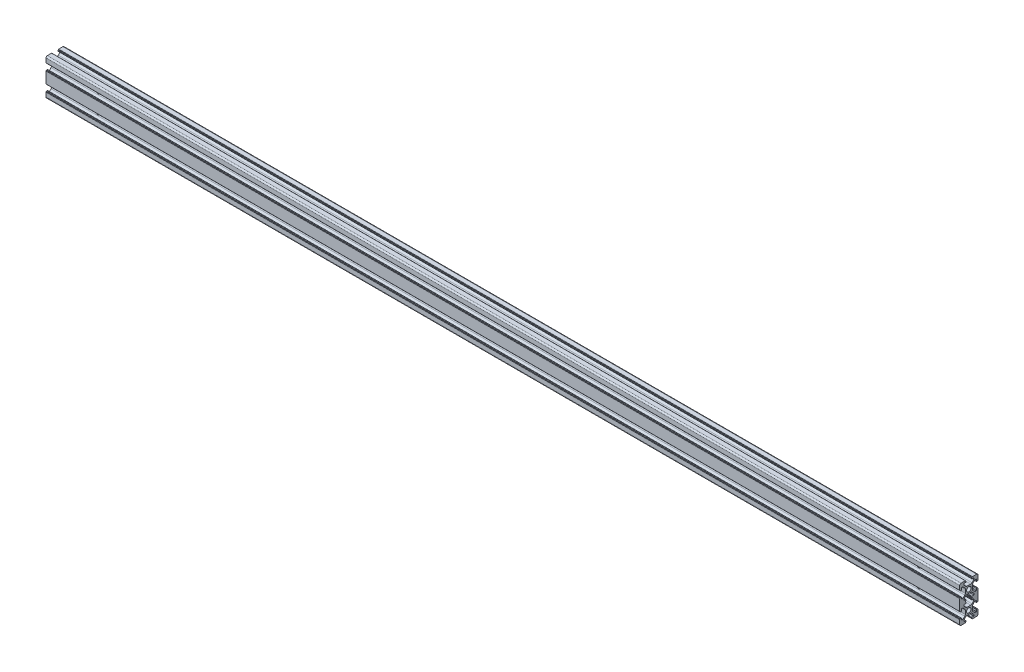
from build123d import *

# Parameters (mm, degrees)
SKETCH11_R                        = 2.500261559
F_2020_V_SLOT_2040_V_SLOT_1_DEPTH = 1000
M5_CLEARANCE_HOLE1_D              = 5.8


with BuildPart() as part:
    # Sketch11 → 2020 v-slot 2040 - V-SLOT(1) (new body)
    with BuildSketch(Plane(origin=(-500, 0, 0), x_dir=(0, 0, 1), z_dir=(1, 0, 0))):
        with BuildLine():
            Line((9.7, 6.4), (9.5, 6.4))
            Line((9.5, 6.4), (9.5, 6.6))
            ThreePointArc((9.5, 6.6), (9.412132034, 6.812132034), (9.2, 6.9))
            Line((9.2, 6.9), (8.5, 6.9))
            ThreePointArc((8.5, 6.9), (8.287867966, 6.812132034), (8.2, 6.6))
            Line((8.2, 6.6), (8.2, 4.8))
            ThreePointArc((8.2, 4.8), (8.112132034, 4.587867966), (7.9, 4.5))
            Line((7.9, 4.5), (6.68492424, 4.5))
            ThreePointArc((6.68492424, 4.5), (6.570119211, 4.52283614), (6.472792206, 4.587867966))
            Line((6.472792206, 4.587867966), (4.485786438, 6.574873734))
            ThreePointArc((4.485786438, 6.574873734), (4.052240935, 7.223720432), (3.9, 7.989087297))
            Line((3.9, 7.989087297), (3.9, 12.010912703))
            ThreePointArc((3.9, 12.010912703), (4.052240935, 12.776279568), (4.485786438, 13.425126266))
            Line((4.485786438, 13.425126266), (6.472792206, 15.412132034))
            ThreePointArc((6.472792206, 15.412132034), (6.570119211, 15.47716386), (6.68492424, 15.5))
            Line((6.68492424, 15.5), (7.9, 15.5))
            ThreePointArc((7.9, 15.5), (8.112132034, 15.412132034), (8.2, 15.2))
            Line((8.2, 15.2), (8.2, 13.4))
            ThreePointArc((8.2, 13.4), (8.287867966, 13.187867966), (8.5, 13.1))
            Line((8.5, 13.1), (9.2, 13.1))
            ThreePointArc((9.2, 13.1), (9.412132034, 13.187867966), (9.5, 13.4))
            Line((9.5, 13.4), (9.5, 13.6))
            Line((9.5, 13.6), (9.7, 13.6))
            ThreePointArc((9.7, 13.6), (9.912132034, 13.687867966), (10, 13.9))
            Line((10, 13.9), (10, 18.5))
            ThreePointArc((10, 18.5), (9.560660172, 19.560660172), (8.5, 20))
            Line((8.5, 20), (3.9, 20))
            ThreePointArc((3.9, 20), (3.687867966, 19.912132034), (3.6, 19.7))
            Line((3.6, 19.7), (3.6, 19.5))
            Line((3.6, 19.5), (3.4, 19.5))
            ThreePointArc((3.4, 19.5), (3.187867966, 19.412132034), (3.1, 19.2))
            Line((3.1, 19.2), (3.1, 18.5))
            ThreePointArc((3.1, 18.5), (3.187867966, 18.287867966), (3.4, 18.2))
            Line((3.4, 18.2), (5.2, 18.2))
            ThreePointArc((5.2, 18.2), (5.412132034, 18.112132034), (5.5, 17.9))
            Line((5.5, 17.9), (5.5, 16.68492424))
            ThreePointArc((5.5, 16.68492424), (5.47716386, 16.570119211), (5.412132034, 16.472792206))
            Line((5.412132034, 16.472792206), (3.425126266, 14.485786438))
            ThreePointArc((3.425126266, 14.485786438), (2.776279568, 14.052240935), (2.010912703, 13.9))
            Line((2.010912703, 13.9), (-2.010912703, 13.9))
            ThreePointArc((-2.010912703, 13.9), (-2.776279568, 14.052240935), (-3.425126266, 14.485786438))
            Line((-3.425126266, 14.485786438), (-5.412132034, 16.472792206))
            ThreePointArc((-5.412132034, 16.472792206), (-5.47716386, 16.570119211), (-5.5, 16.68492424))
            Line((-5.5, 16.68492424), (-5.5, 17.9))
            ThreePointArc((-5.5, 17.9), (-5.412132034, 18.112132034), (-5.2, 18.2))
            Line((-5.2, 18.2), (-3.4, 18.2))
            ThreePointArc((-3.4, 18.2), (-3.187867966, 18.287867966), (-3.1, 18.5))
            Line((-3.1, 18.5), (-3.1, 19.2))
            ThreePointArc((-3.1, 19.2), (-3.187867966, 19.412132034), (-3.4, 19.5))
            Line((-3.4, 19.5), (-3.6, 19.5))
            Line((-3.6, 19.5), (-3.6, 19.7))
            ThreePointArc((-3.6, 19.7), (-3.687867966, 19.912132034), (-3.9, 20))
            Line((-3.9, 20), (-8.5, 20))
            ThreePointArc((-8.5, 20), (-9.560660172, 19.560660172), (-10, 18.5))
            Line((-10, 18.5), (-10, 13.9))
            ThreePointArc((-10, 13.9), (-9.912132034, 13.687867966), (-9.7, 13.6))
            Line((-9.7, 13.6), (-9.5, 13.6))
            Line((-9.5, 13.6), (-9.5, 13.4))
            ThreePointArc((-9.5, 13.4), (-9.412132034, 13.187867966), (-9.2, 13.1))
            Line((-9.2, 13.1), (-8.5, 13.1))
            ThreePointArc((-8.5, 13.1), (-8.287867966, 13.187867966), (-8.2, 13.4))
            Line((-8.2, 13.4), (-8.2, 15.2))
            ThreePointArc((-8.2, 15.2), (-8.112132034, 15.412132034), (-7.9, 15.5))
            Line((-7.9, 15.5), (-6.68492424, 15.5))
            ThreePointArc((-6.68492424, 15.5), (-6.570119211, 15.47716386), (-6.472792206, 15.412132034))
            Line((-6.472792206, 15.412132034), (-4.485786438, 13.425126266))
            ThreePointArc((-4.485786438, 13.425126266), (-4.052240935, 12.776279568), (-3.9, 12.010912703))
            Line((-3.9, 12.010912703), (-3.9, 7.989087297))
            ThreePointArc((-3.9, 7.989087297), (-4.052240935, 7.223720432), (-4.485786438, 6.574873734))
            Line((-4.485786438, 6.574873734), (-6.472792206, 4.587867966))
            ThreePointArc((-6.472792206, 4.587867966), (-6.570119211, 4.52283614), (-6.68492424, 4.5))
            Line((-6.68492424, 4.5), (-7.9, 4.5))
            ThreePointArc((-7.9, 4.5), (-8.112132034, 4.587867966), (-8.2, 4.8))
            Line((-8.2, 4.8), (-8.2, 6.6))
            ThreePointArc((-8.2, 6.6), (-8.287867966, 6.812132034), (-8.5, 6.9))
            Line((-8.5, 6.9), (-9.2, 6.9))
            ThreePointArc((-9.2, 6.9), (-9.412132034, 6.812132034), (-9.5, 6.6))
            Line((-9.5, 6.6), (-9.5, 6.4))
            Line((-9.5, 6.4), (-9.7, 6.4))
            ThreePointArc((-9.7, 6.4), (-9.912132034, 6.312132034), (-10, 6.1))
            Line((-10, 6.1), (-10, 1.5))
            Line((-10, 1.5), (-10, -1.5))
            Line((-10, -1.5), (-10, -6.1))
            ThreePointArc((-10, -6.1), (-9.912132034, -6.312132034), (-9.7, -6.4))
            Line((-9.7, -6.4), (-9.5, -6.4))
            Line((-9.5, -6.4), (-9.5, -6.6))
            ThreePointArc((-9.5, -6.6), (-9.412132034, -6.812132034), (-9.2, -6.9))
            Line((-9.2, -6.9), (-8.5, -6.9))
            ThreePointArc((-8.5, -6.9), (-8.287867966, -6.812132034), (-8.2, -6.6))
            Line((-8.2, -6.6), (-8.2, -4.8))
            ThreePointArc((-8.2, -4.8), (-8.112132034, -4.587867966), (-7.9, -4.5))
            Line((-7.9, -4.5), (-6.68492424, -4.5))
            ThreePointArc((-6.68492424, -4.5), (-6.570119211, -4.52283614), (-6.472792206, -4.587867966))
            Line((-6.472792206, -4.587867966), (-4.485786438, -6.574873734))
            ThreePointArc((-4.485786438, -6.574873734), (-4.052240935, -7.223720432), (-3.9, -7.989087297))
            Line((-3.9, -7.989087297), (-3.9, -12.010912703))
            ThreePointArc((-3.9, -12.010912703), (-4.052240935, -12.776279568), (-4.485786438, -13.425126266))
            Line((-4.485786438, -13.425126266), (-6.472792206, -15.412132034))
            ThreePointArc((-6.472792206, -15.412132034), (-6.570119211, -15.47716386), (-6.68492424, -15.5))
            Line((-6.68492424, -15.5), (-7.9, -15.5))
            ThreePointArc((-7.9, -15.5), (-8.112132034, -15.412132034), (-8.2, -15.2))
            Line((-8.2, -15.2), (-8.2, -13.4))
            ThreePointArc((-8.2, -13.4), (-8.287867966, -13.187867966), (-8.5, -13.1))
            Line((-8.5, -13.1), (-9.2, -13.1))
            ThreePointArc((-9.2, -13.1), (-9.412132034, -13.187867966), (-9.5, -13.4))
            Line((-9.5, -13.4), (-9.5, -13.6))
            Line((-9.5, -13.6), (-9.7, -13.6))
            ThreePointArc((-9.7, -13.6), (-9.912132034, -13.687867966), (-10, -13.9))
            Line((-10, -13.9), (-10, -18.5))
            ThreePointArc((-10, -18.5), (-9.560660172, -19.560660172), (-8.5, -20))
            Line((-8.5, -20), (-3.9, -20))
            ThreePointArc((-3.9, -20), (-3.687867966, -19.912132034), (-3.6, -19.7))
            Line((-3.6, -19.7), (-3.6, -19.5))
            Line((-3.6, -19.5), (-3.4, -19.5))
            ThreePointArc((-3.4, -19.5), (-3.187867966, -19.412132034), (-3.1, -19.2))
            Line((-3.1, -19.2), (-3.1, -18.5))
            ThreePointArc((-3.1, -18.5), (-3.187867966, -18.287867966), (-3.4, -18.2))
            Line((-3.4, -18.2), (-5.2, -18.2))
            ThreePointArc((-5.2, -18.2), (-5.412132034, -18.112132034), (-5.5, -17.9))
            Line((-5.5, -17.9), (-5.5, -16.68492424))
            ThreePointArc((-5.5, -16.68492424), (-5.47716386, -16.570119211), (-5.412132034, -16.472792206))
            Line((-5.412132034, -16.472792206), (-3.425126266, -14.485786438))
            ThreePointArc((-3.425126266, -14.485786438), (-2.776279568, -14.052240935), (-2.010912703, -13.9))
            Line((-2.010912703, -13.9), (2.010912703, -13.9))
            ThreePointArc((2.010912703, -13.9), (2.776279568, -14.052240935), (3.425126266, -14.485786438))
            Line((3.425126266, -14.485786438), (5.412132034, -16.472792206))
            ThreePointArc((5.412132034, -16.472792206), (5.47716386, -16.570119211), (5.5, -16.68492424))
            Line((5.5, -16.68492424), (5.5, -17.9))
            ThreePointArc((5.5, -17.9), (5.412132034, -18.112132034), (5.2, -18.2))
            Line((5.2, -18.2), (3.4, -18.2))
            ThreePointArc((3.4, -18.2), (3.187867966, -18.287867966), (3.1, -18.5))
            Line((3.1, -18.5), (3.1, -19.2))
            ThreePointArc((3.1, -19.2), (3.187867966, -19.412132034), (3.4, -19.5))
            Line((3.4, -19.5), (3.6, -19.5))
            Line((3.6, -19.5), (3.6, -19.7))
            ThreePointArc((3.6, -19.7), (3.687867966, -19.912132034), (3.9, -20))
            Line((3.9, -20), (8.5, -20))
            ThreePointArc((8.5, -20), (9.560660172, -19.560660172), (10, -18.5))
            Line((10, -18.5), (10, -13.9))
            ThreePointArc((10, -13.9), (9.912132034, -13.687867966), (9.7, -13.6))
            Line((9.7, -13.6), (9.5, -13.6))
            Line((9.5, -13.6), (9.5, -13.4))
            ThreePointArc((9.5, -13.4), (9.412132034, -13.187867966), (9.2, -13.1))
            Line((9.2, -13.1), (8.5, -13.1))
            ThreePointArc((8.5, -13.1), (8.287867966, -13.187867966), (8.2, -13.4))
            Line((8.2, -13.4), (8.2, -15.2))
            ThreePointArc((8.2, -15.2), (8.112132034, -15.412132034), (7.9, -15.5))
            Line((7.9, -15.5), (6.68492424, -15.5))
            ThreePointArc((6.68492424, -15.5), (6.570119211, -15.47716386), (6.472792206, -15.412132034))
            Line((6.472792206, -15.412132034), (4.485786438, -13.425126266))
            ThreePointArc((4.485786438, -13.425126266), (4.052240935, -12.776279568), (3.9, -12.010912703))
            Line((3.9, -12.010912703), (3.9, -7.989087297))
            ThreePointArc((3.9, -7.989087297), (4.052240935, -7.223720432), (4.485786438, -6.574873734))
            Line((4.485786438, -6.574873734), (6.472792206, -4.587867966))
            ThreePointArc((6.472792206, -4.587867966), (6.570119211, -4.52283614), (6.68492424, -4.5))
            Line((6.68492424, -4.5), (7.9, -4.5))
            ThreePointArc((7.9, -4.5), (8.112132034, -4.587867966), (8.2, -4.8))
            Line((8.2, -4.8), (8.2, -6.6))
            ThreePointArc((8.2, -6.6), (8.287867966, -6.812132034), (8.5, -6.9))
            Line((8.5, -6.9), (9.2, -6.9))
            ThreePointArc((9.2, -6.9), (9.412132034, -6.812132034), (9.5, -6.6))
            Line((9.5, -6.6), (9.5, -6.4))
            Line((9.5, -6.4), (9.7, -6.4))
            ThreePointArc((9.7, -6.4), (9.912132034, -6.312132034), (10, -6.1))
            Line((10, -6.1), (10, -1.5))
            Line((10, -1.5), (10, 1.5))
            Line((10, 1.5), (10, 6.1))
            ThreePointArc((10, 6.1), (9.912132034, 6.312132034), (9.7, 6.4))
        make_face()
        with Locations((0.000261521, 10.000437397)):
            Circle(SKETCH11_R, mode=Mode.SUBTRACT)
        with Locations((0.000261521, -10.000437397)):
            Circle(SKETCH11_R, mode=Mode.SUBTRACT)
        with BuildLine():
            Line((-3.1, 0.8), (-3.1, 1.5))
            ThreePointArc((-3.1, 1.5), (-3.187867966, 1.712132034), (-3.4, 1.8))
            Line((-3.4, 1.8), (-5.2, 1.8))
            ThreePointArc((-5.2, 1.8), (-5.412132034, 1.887867966), (-5.5, 2.1))
            Line((-5.5, 2.1), (-5.5, 3.31507576))
            ThreePointArc((-5.5, 3.31507576), (-5.47716386, 3.429880789), (-5.412132034, 3.527207794))
            Line((-5.412132034, 3.527207794), (-3.425126266, 5.514213562))
            ThreePointArc((-3.425126266, 5.514213562), (-2.776279568, 5.947759065), (-2.010912703, 6.1))
            Line((-2.010912703, 6.1), (2.010912703, 6.1))
            ThreePointArc((2.010912703, 6.1), (2.776279568, 5.947759065), (3.425126266, 5.514213562))
            Line((3.425126266, 5.514213562), (5.412132034, 3.527207794))
            ThreePointArc((5.412132034, 3.527207794), (5.47716386, 3.429880789), (5.5, 3.31507576))
            Line((5.5, 3.31507576), (5.5, 2.1))
            ThreePointArc((5.5, 2.1), (5.412132034, 1.887867966), (5.2, 1.8))
            Line((5.2, 1.8), (3.4, 1.8))
            ThreePointArc((3.4, 1.8), (3.187867966, 1.712132034), (3.1, 1.5))
            Line((3.1, 1.5), (3.1, 0.8))
            ThreePointArc((3.1, 0.8), (3.187867966, 0.587867966), (3.4, 0.5))
            ThreePointArc((3.4, 0.5), (3.541421356, 0.441421356), (3.6, 0.3))
            ThreePointArc((3.6, 0.3), (3.687867966, 0.087867966), (3.9, 0))
            ThreePointArc((3.9, 0), (3.687867966, -0.087867966), (3.6, -0.3))
            ThreePointArc((3.6, -0.3), (3.541421356, -0.441421356), (3.4, -0.5))
            ThreePointArc((3.4, -0.5), (3.187867966, -0.587867966), (3.1, -0.8))
            Line((3.1, -0.8), (3.1, -1.5))
            ThreePointArc((3.1, -1.5), (3.187867966, -1.712132034), (3.4, -1.8))
            Line((3.4, -1.8), (5.2, -1.8))
            ThreePointArc((5.2, -1.8), (5.412132034, -1.887867966), (5.5, -2.1))
            Line((5.5, -2.1), (5.5, -3.31507576))
            ThreePointArc((5.5, -3.31507576), (5.47716386, -3.429880789), (5.412132034, -3.527207794))
            Line((5.412132034, -3.527207794), (3.425126266, -5.514213562))
            ThreePointArc((3.425126266, -5.514213562), (2.776279568, -5.947759065), (2.010912703, -6.1))
            Line((2.010912703, -6.1), (-2.010912703, -6.1))
            ThreePointArc((-2.010912703, -6.1), (-2.776279568, -5.947759065), (-3.425126266, -5.514213562))
            Line((-3.425126266, -5.514213562), (-5.412132034, -3.527207794))
            ThreePointArc((-5.412132034, -3.527207794), (-5.47716386, -3.429880789), (-5.5, -3.31507576))
            Line((-5.5, -3.31507576), (-5.5, -2.1))
            ThreePointArc((-5.5, -2.1), (-5.412132034, -1.887867966), (-5.2, -1.8))
            Line((-5.2, -1.8), (-3.4, -1.8))
            ThreePointArc((-3.4, -1.8), (-3.187867966, -1.712132034), (-3.1, -1.5))
            Line((-3.1, -1.5), (-3.1, -0.8))
            ThreePointArc((-3.1, -0.8), (-3.187867966, -0.587867966), (-3.4, -0.5))
            ThreePointArc((-3.4, -0.5), (-3.541421356, -0.441421356), (-3.6, -0.3))
            ThreePointArc((-3.6, -0.3), (-3.687867966, -0.087867966), (-3.9, 0))
            ThreePointArc((-3.9, 0), (-3.687867966, 0.087867966), (-3.6, 0.3))
            ThreePointArc((-3.6, 0.3), (-3.541421356, 0.441421356), (-3.4, 0.5))
            ThreePointArc((-3.4, 0.5), (-3.187867966, 0.587867966), (-3.1, 0.8))
        make_face(mode=Mode.SUBTRACT)
    extrude(amount=F_2020_V_SLOT_2040_V_SLOT_1_DEPTH)

    # M5 Clearance Hole1 (through all)
    with Locations(Plane.XY.offset(10)):
        with Locations((-449, 10), (-449, -10)):
            m5_clearance_hole1 = Hole(M5_CLEARANCE_HOLE1_D / 2)

    # Mirror1: M5 Clearance Hole1 across plane
    add(m5_clearance_hole1.mirror(Plane(origin=(0, 0, 0), x_dir=(0, 0, 1), z_dir=(1, 0, 0))), mode=Mode.SUBTRACT)


solid = part.part
